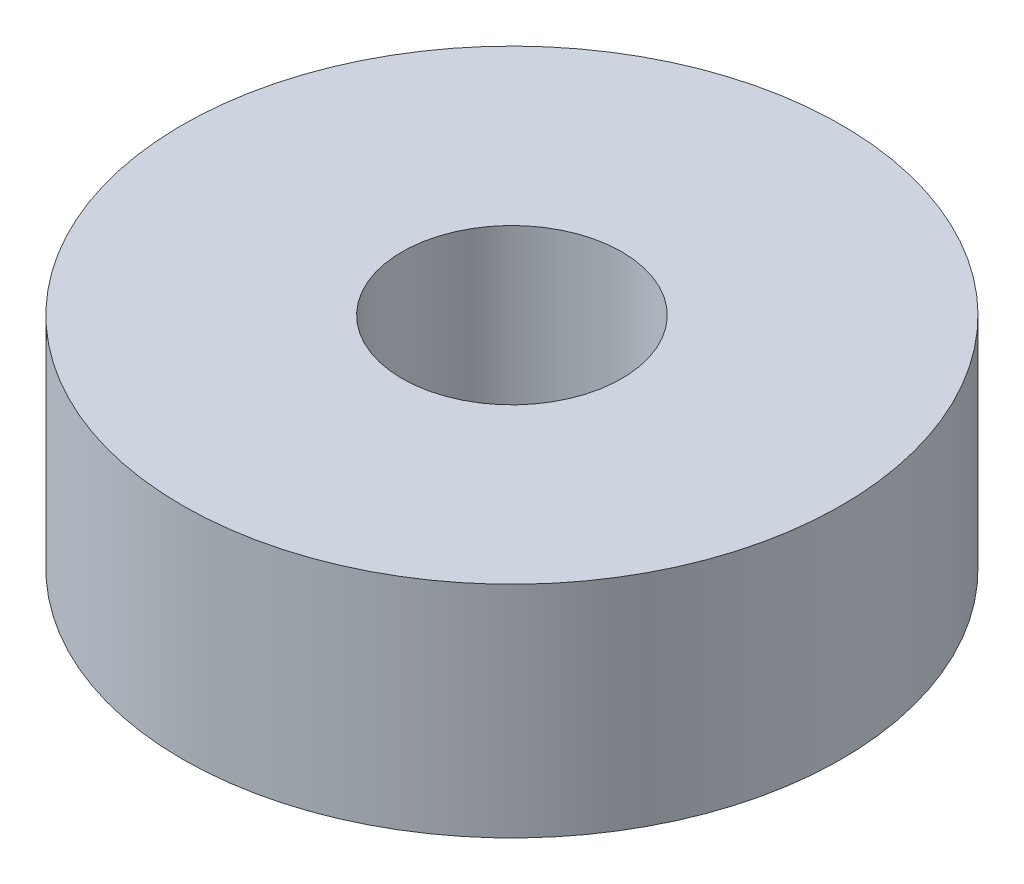
from build123d import *

# Parameters (mm, degrees)
SKETCH1_R           = 9.525
SKETCH1_R_2         = 3.175
BOSS_EXTRUDE1_DEPTH = 3.175


with BuildPart() as part:
    # Sketch1 → Boss-Extrude1 (new, symmetric)
    with BuildSketch(Plane(origin=(0, 0, 0), x_dir=(1, 0, 0), z_dir=(0, 1, 0))):
        with Locations(Location((0, 0, 0), (0, 0, 270))):
            Circle(SKETCH1_R)
        with Locations(Location((0, 0, 0), (0, 0, 270))):
            Circle(SKETCH1_R_2, mode=Mode.SUBTRACT)
    extrude(amount=BOSS_EXTRUDE1_DEPTH, both=True)


solid = part.part
